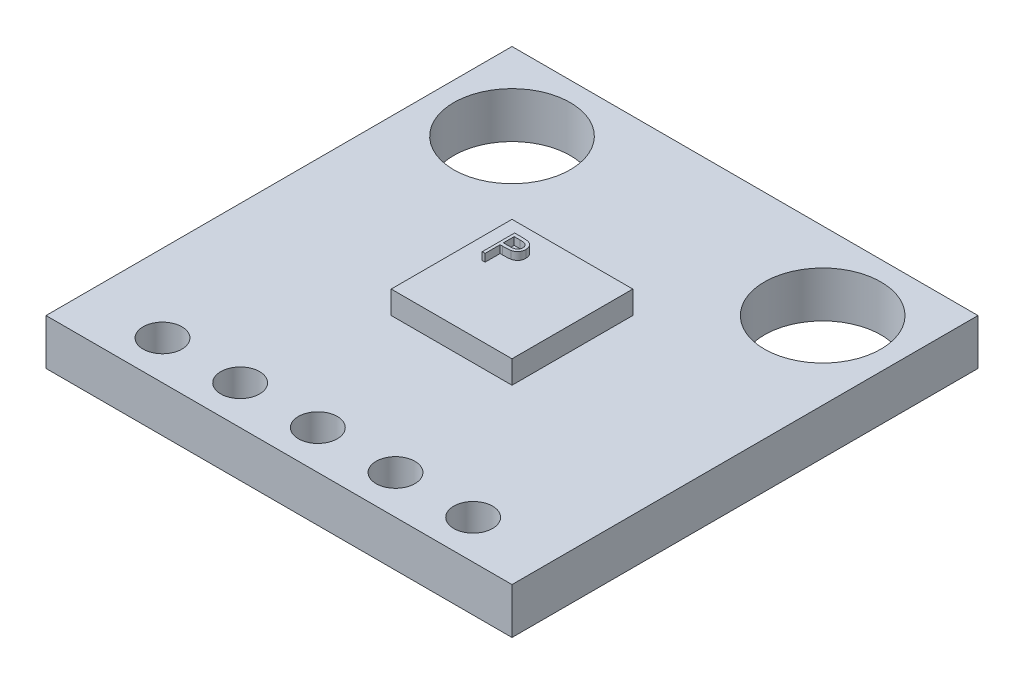
from build123d import *

# Parameters (mm, degrees)
SKETCH1_W           = 15.24
SKETCH1_H           = 15.24
BOSS_EXTRUDE1_DEPTH = 1.5
SKETCH2_R           = 1.905
SKETCH2_R_2         = 0.635
CUT_EXTRUDE1_DEPTH  = 11.880202204
SKETCH3_W           = 3.95
SKETCH3_H           = 3.95
BOSS_EXTRUDE2_DEPTH = 0.75
BOSS_EXTRUDE3_DEPTH = 0.25


with BuildPart() as part:
    # Sketch1 → Boss-Extrude1 (new body)
    with BuildSketch(Plane(origin=(0, 0, 0), x_dir=(1, 0, 0), z_dir=(0, 1, 0))):
        Rectangle(SKETCH1_W, SKETCH1_H)
    extrude(amount=BOSS_EXTRUDE1_DEPTH)

    # Sketch2 → Cut-Extrude1 (cut, through all)
    with BuildSketch(Plane(origin=(0, 1.5, 0), x_dir=(1, 0, 0), z_dir=(0, 1, 0))):
        with Locations(Location((-5.08, 5.08, 0), (0, 0, 270))):
            Circle(SKETCH2_R)
        with Locations(Location((5.08, 5.08, 0), (0, 0, 270))):
            Circle(SKETCH2_R)
        with Locations(Location((5.08, -6.35, 0), (0, 0, 270))):
            Circle(SKETCH2_R_2)
        with Locations(Location((2.54, -6.35, 0), (0, 0, 270))):
            Circle(SKETCH2_R_2)
        with Locations(Location((0, -6.35, 0), (0, 0, 270))):
            Circle(SKETCH2_R_2)
        with Locations(Location((-2.54, -6.35, 0), (0, 0, 270))):
            Circle(SKETCH2_R_2)
        with Locations(Location((-5.08, -6.35, 0), (0, 0, 270))):
            Circle(SKETCH2_R_2)
    extrude(amount=-CUT_EXTRUDE1_DEPTH, mode=Mode.SUBTRACT)

    # Sketch3 → Boss-Extrude2 (add)
    with BuildSketch(Plane(origin=(0, 1.5, 0), x_dir=(1, 0, 0), z_dir=(0, 1, 0))):
        Rectangle(SKETCH3_W, SKETCH3_H)
    extrude(amount=BOSS_EXTRUDE2_DEPTH)

    # Sketch4 → Boss-Extrude3 (add)
    with BuildSketch(Plane(origin=(0, 2.25, 0), x_dir=(1, 0, 0), z_dir=(0, 1, 0))):
        with BuildLine():
            Line((-1.295144256, 1.380499313), (-1.087590503, 1.380499313))
            add(Edge.make_bspline(
                [(-1.087590503, 1.380499313), (-1.073314825, 1.38048362), (-1.04596199, 1.380453553), (-1.006738628, 1.379541951), (-0.971115209, 1.378324356), (-0.939168546, 1.376636498), (-0.910800345, 1.374641815), (-0.886138971, 1.371844174), (-0.864990582, 1.368923085), (-0.85231887, 1.365953279), (-0.846539822, 1.364598872)],
                knots=[0, 0, 0, 0, 1.415646017, 2.712440637, 3.8905458, 4.950247383, 5.884950622, 6.709939814, 7.411656543, 8, 8, 8, 8], degree=3))
            add(Edge.make_bspline(
                [(-0.846539822, 1.364598872), (-0.839224159, 1.362596521), (-0.824765215, 1.358639001), (-0.803930852, 1.35071247), (-0.784108618, 1.341313815), (-0.765230504, 1.33060229), (-0.747528493, 1.318118322), (-0.730738476, 1.304367966), (-0.715008625, 1.289033754), (-0.700427395, 1.272287673), (-0.687036515, 1.254410848), (-0.675506825, 1.235136412), (-0.66585264, 1.214788803), (-0.65757246, 1.193382176), (-0.651612999, 1.170736768), (-0.64712358, 1.147009929), (-0.644274054, 1.122204201), (-0.644001137, 1.105252765), (-0.643862205, 1.096623445)],
                knots=[0, 0, 0, 0, 0.999701418, 1.975846123, 2.934577507, 3.890451536, 4.834027766, 5.787354733, 6.749476667, 7.726910423, 8.712836071, 9.690891519, 10.682875813, 11.679750201, 12.712814741, 13.765529915, 14.8625177, 16, 16, 16, 16], degree=3))
            add(Edge.make_bspline(
                [(-0.643862205, 1.096623445), (-0.643989636, 1.087921593), (-0.644238963, 1.070895833), (-0.647231411, 1.045987871), (-0.651262207, 1.022184929), (-0.657460125, 0.999539786), (-0.665577745, 0.978186922), (-0.675100342, 0.957800025), (-0.686585838, 0.938725934), (-0.699783203, 0.920895401), (-0.714464281, 0.904291689), (-0.730566955, 0.889035121), (-0.748026217, 0.875214999), (-0.766786581, 0.862800343), (-0.78703094, 0.852079039), (-0.808452258, 0.842476235), (-0.831236728, 0.834411414), (-0.847003631, 0.830168991), (-0.855020057, 0.828012)],
                knots=[0, 0, 0, 0, 1.121902311, 2.195077645, 3.232258892, 4.234102512, 5.217864754, 6.176164875, 7.132989551, 8.084763148, 9.034132444, 9.988522005, 10.94243251, 11.903244335, 12.886203696, 13.894208494, 14.929344452, 16, 16, 16, 16], degree=3))
            add(Edge.make_bspline(
                [(-0.855020057, 0.828012), (-0.861650466, 0.826602003), (-0.87618139, 0.823511913), (-0.900112642, 0.820062213), (-0.927975652, 0.817117748), (-0.959732389, 0.814910024), (-0.995354348, 0.813020031), (-1.0348608, 0.811517774), (-1.078329294, 0.810692318), (-1.108649409, 0.810649745), (-1.124479526, 0.810627518)],
                knots=[0, 0, 0, 0, 0.601384939, 1.31797006, 2.144135048, 3.087295005, 4.142315834, 5.309527816, 6.595305764, 8, 8, 8, 8], degree=3))
            Line((-1.124479526, 0.810627518), (-1.200165624, 0.810627518))
            Line((-1.200165624, 0.810627518), (-1.200165624, 0.322165979))
            Line((-1.200165624, 0.322165979), (-1.295144256, 0.322165979))
            Line((-1.295144256, 0.322165979), (-1.295144256, 1.380499313))
        make_face()
        with BuildLine():
            Line((-1.200165624, 1.271952304), (-1.200165624, 0.919174527))
            Line((-1.200165624, 0.919174527), (-1.014872488, 0.916842462))
            add(Edge.make_bspline(
                [(-1.014872488, 0.916842462), (-1.005825272, 0.916837786), (-0.988359809, 0.916828759), (-0.963130284, 0.918033815), (-0.93972319, 0.919424928), (-0.918210426, 0.921461743), (-0.898582293, 0.92434079), (-0.880806064, 0.927247197), (-0.865019576, 0.931451913), (-0.846544342, 0.937113413), (-0.825957234, 0.946769228), (-0.803560618, 0.960784552), (-0.784579989, 0.978649432), (-0.76815517, 0.998735943), (-0.755120774, 1.021081632), (-0.745578843, 1.044990573), (-0.73997235, 1.070217565), (-0.739220572, 1.087479931), (-0.738840837, 1.096199433)],
                knots=[0, 0, 0, 0, 1.160613943, 2.240541288, 3.23993089, 4.169200891, 5.011653406, 5.7853311, 6.478053781, 7.106038997, 8.262395093, 9.384106736, 10.481365981, 11.59014053, 12.70357646, 13.786202915, 14.881775077, 16, 16, 16, 16], degree=3))
            add(Edge.make_bspline(
                [(-0.738840837, 1.096199433), (-0.739222638, 1.104707984), (-0.739981609, 1.121621929), (-0.745622787, 1.146410745), (-0.755102222, 1.170067731), (-0.768242669, 1.192133402), (-0.784190582, 1.212147636), (-0.802726336, 1.229533672), (-0.823806298, 1.243510235), (-0.843415168, 1.252531251), (-0.860832669, 1.258039203), (-0.875961381, 1.261893), (-0.893043085, 1.264969909), (-0.912083342, 1.267461378), (-0.932934575, 1.26959421), (-0.955775923, 1.271041399), (-0.980520858, 1.271888506), (-0.997699292, 1.271930523), (-1.006604259, 1.271952304)],
                knots=[0, 0, 0, 0, 1.120700087, 2.227813068, 3.331159281, 4.466773991, 5.599788987, 6.693661531, 7.80175334, 8.91857717, 9.525282508, 10.207424825, 10.974604443, 11.810962634, 12.737642355, 13.736264703, 14.826523623, 16, 16, 16, 16], degree=3))
            Line((-1.006604259, 1.271952304), (-1.200165624, 1.271952304))
        make_face(mode=Mode.SUBTRACT)
    extrude(amount=BOSS_EXTRUDE3_DEPTH)


solid = part.part
